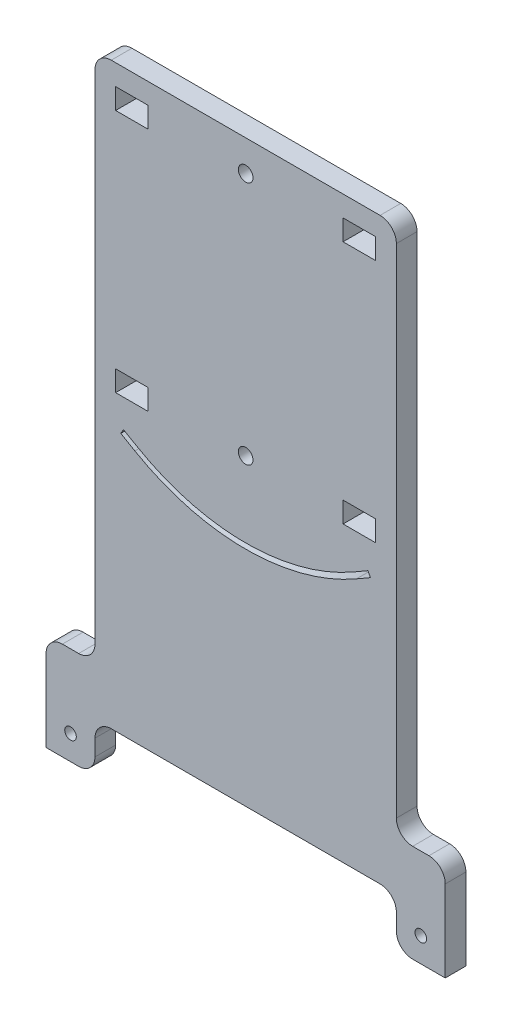
from build123d import *

# Parameters (mm, degrees)
MAIN_W                 = 20
MAIN_H                 = 12.7
BOSS_EXTRUDE1_DEPTH    = 6.35
M6_5_CLEARANCE_HOLE1_D = 7.1
CUT_EXTRUDE1_DEPTH     = 229.693747182
M8_CLEARANCE_HOLE1_D   = 9
FILLET1_R              = 10


with BuildPart() as part:
    # MAIN → Boss-Extrude1 (new, symmetric)
    # profile 1 of 3: a face of its own
    with BuildSketch(Plane.XY):
        Polygon((92.5, 192.7), (-92.5, 192.7), (-92.5, -132.7), (-92.5, -162.7), (92.5, -162.7), (92.5, -132.7), align=None)
        with Locations((-69.8, 23.65)):
            Rectangle(MAIN_W, MAIN_H, mode=Mode.SUBTRACT)
        with Locations((-69.8, 173.65)):
            Rectangle(MAIN_W, MAIN_H, mode=Mode.SUBTRACT)
        with Locations((69.8, 23.65)):
            Rectangle(MAIN_W, MAIN_H, mode=Mode.SUBTRACT)
        with Locations((69.8, 173.65)):
            Rectangle(MAIN_W, MAIN_H, mode=Mode.SUBTRACT)
    # profile 2 of 3: a face of its own
    with BuildSketch(Plane.XY):
        Polygon((-92.5, -162.7), (-92.5, -132.7), (-122.5, -132.7), (-122.5, -192.7), (-92.5, -192.7), align=None)
    # profile 3 of 3: a face of its own
    with BuildSketch(Plane.XY):
        Polygon((122.5, -132.7), (92.5, -132.7), (92.5, -162.7), (92.5, -192.7), (122.5, -192.7), align=None)
    extrude(amount=BOSS_EXTRUDE1_DEPTH, both=True)

    # M6.5 Clearance Hole1 (through all)
    with Locations(Plane.XY.offset(6.35)):
        with Locations((-107.5, -177.7), (107.5, -177.7)):
            Hole(M6_5_CLEARANCE_HOLE1_D / 2)

    # Sketch1 → Cut-Extrude1 (cut, through all)
    with BuildSketch(Plane.XY.offset(6.35)):
        with BuildLine():
            Line((-67.989745962, -7.782202476), (-76.65, -2.782202476))
            Line((-76.65, -2.782202476), (-75, 0.075681357))
            Line((-75, 0.075681357), (-66.339745962, -4.924318643))
            ThreePointArc((-66.339745962, -4.924318643), (0, -22.7), (66.339745962, -4.924318643))
            Line((66.339745962, -4.924318643), (75, 0.075681357))
            Line((75, 0.075681357), (76.65, -2.782202476))
            Line((76.65, -2.782202476), (67.989745962, -7.782202476))
            ThreePointArc((67.989745962, -7.782202476), (0, -26), (-67.989745962, -7.782202476))
        make_face()
    extrude(amount=-CUT_EXTRUDE1_DEPTH, mode=Mode.SUBTRACT)

    # M8 Clearance Hole1 (through all)
    with Locations(Plane.XY.offset(6.35)):
        with Locations((0, 173.65), (0, 23.65)):
            Hole(M8_CLEARANCE_HOLE1_D / 2)

    # Fillet1
    fillet1_edges = [part.edges().sort_by_distance(p)[0] for p in [
        (-92.5, 192.7, 0),
        (92.5, 192.7, 0),
        (92.5, -132.7, 0),
        (122.5, -132.7, 0),
        (92.5, -192.7, 0),
        (92.5, -162.7, 0),
        (-92.5, -162.7, 0),
        (-92.5, -192.7, 0),
        (-122.5, -132.7, 0),
        (-92.5, -132.7, 0),
    ]]
    fillet(fillet1_edges, radius=FILLET1_R)


solid = part.part
